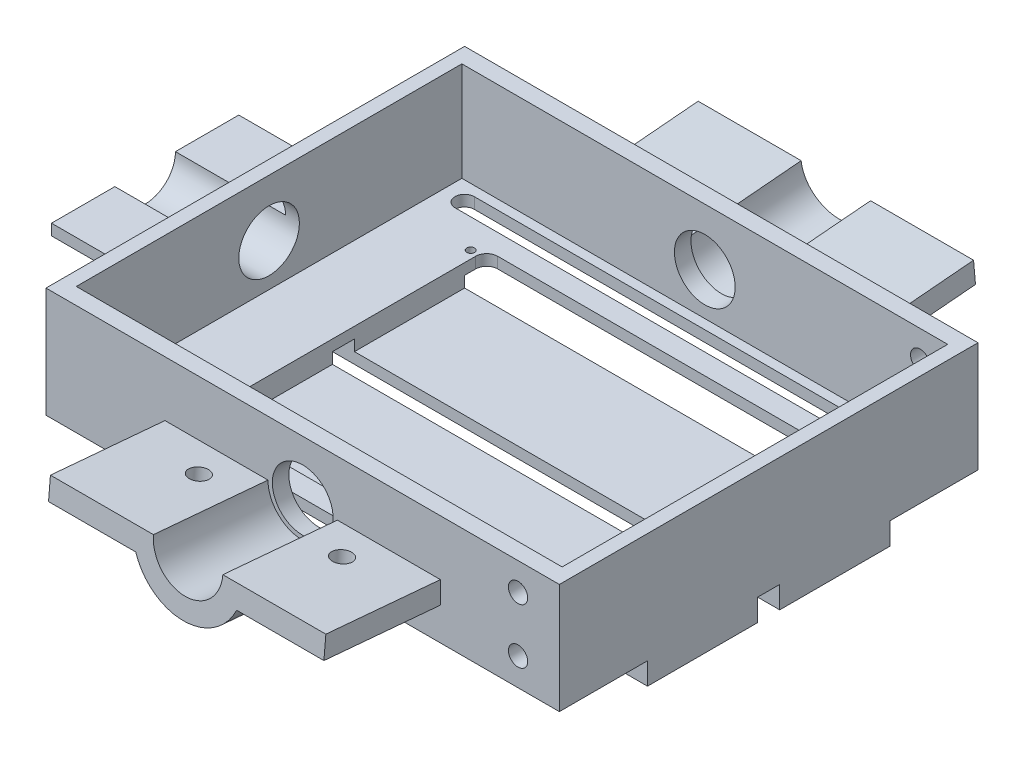
from build123d import *

# Parameters (mm, degrees)
SKETCH1_W            = 7.62
SKETCH1_H            = 88.9
SKETCH1_R            = 0.9
SKETCH1_W_2          = 9.525
BOSS_EXTRUDE1_DEPTH  = 2.54
BOSS_EXTRUDE2_DEPTH  = 25.4
BOSS_EXTRUDE6_DEPTH  = 25.4
BOSS_EXTRUDE7_REACH  = 142.673
SKETCH9_R            = 2.2225
CUT_EXTRUDE2_DEPTH   = 5.08
CUT_EXTRUDE5_REACH   = 142.673
SKETCH15_R           = 7
BOSS_EXTRUDE8_REACH  = 142.673
CUT_EXTRUDE8_REACH   = 142.199
SKETCH19_R           = 6.985
BOSS_EXTRUDE9_DEPTH  = 25.4
CUT_EXTRUDE9_REACH   = 116.313
SKETCH22_R           = 2.2225
SKETCH27_W           = 20.32
SKETCH27_H           = 25.4
BOSS_EXTRUDE12_DEPTH = 5.08
BOSS_EXTRUDE13_REACH = 128.491
SKETCH28_W           = 25.4
SKETCH28_H           = 2.54
SKETCH30_W           = 77.724
SKETCH30_H           = 8.89
BOSS_EXTRUDE14_DEPTH = 2.54
CUT_EXTRUDE10_REACH  = 117.84
SKETCH29_R           = 2.2225
SKETCH32_R           = 2.2225
CUT_EXTRUDE11_DEPTH  = 153.264497495
SKETCH33_W           = 77.724
SKETCH33_H           = 2.54
BOSS_EXTRUDE17_DEPTH = 2.54
FILLET2_R            = 2.54


with BuildPart() as part:
    # Sketch1 → Boss-Extrude1 (new body)
    # profile 1 of 4: a face of its own
    with BuildSketch(Plane(origin=(0, 0, 0), x_dir=(1, 0, 0), z_dir=(0, 1, 0))):
        with Locations((-42.672, 0)):
            Rectangle(SKETCH1_W, SKETCH1_H)
        with Locations(Location((-40.64, -31.115, 0), (0, 0, 270))):
            Circle(SKETCH1_R, mode=Mode.SUBTRACT)
        with Locations(Location((-40.64, 31.115, 0), (0, 0, 270))):
            Circle(SKETCH1_R, mode=Mode.SUBTRACT)
    # profile 2 of 4: a face of its own
    with BuildSketch(Plane(origin=(0, 0, 0), x_dir=(1, 0, 0), z_dir=(0, 1, 0))):
        with Locations((42.672, 0)):
            Rectangle(SKETCH1_W, SKETCH1_H)
        with Locations(Location((40.64, -31.115, 0), (0, 0, 270))):
            Circle(SKETCH1_R, mode=Mode.SUBTRACT)
        with Locations(Location((40.64, 31.115, 0), (0, 0, 270))):
            Circle(SKETCH1_R, mode=Mode.SUBTRACT)
    # profile 3 of 4: a face of its own
    with BuildSketch(Plane(origin=(0, 0, 0), x_dir=(1, 0, 0), z_dir=(0, 1, 0))):
        with Locations((-51.2445, 0)):
            Rectangle(SKETCH1_W_2, SKETCH1_H)
    # profile 4 of 4: a face of its own
    with BuildSketch(Plane(origin=(0, 0, 0), x_dir=(1, 0, 0), z_dir=(0, 1, 0))):
        with Locations((51.2445, 0)):
            Rectangle(SKETCH1_W_2, SKETCH1_H)
    extrude(amount=BOSS_EXTRUDE1_DEPTH)

    # Sketch1<3> → Boss-Extrude2 (add)
    with BuildSketch(Plane(origin=(0, 0, 0), x_dir=(1, 0, 0), z_dir=(0, 1, 0))):
        Polygon((-56.007, -48.26), (-56.007, -44.45), (-56.007, 44.45), (-56.007, 48.26), (-59.182, 48.26), (-59.182, -48.26), align=None)
        Polygon((56.007, -44.45), (56.007, -48.26), (59.182, -48.26), (59.182, 48.26), (56.007, 48.26), (56.007, 44.45), align=None)
        Polygon((-38.862, -44.45), (-46.482, -44.45), (-56.007, -44.45), (-56.007, -48.26), (56.007, -48.26), (56.007, -44.45), (46.482, -44.45), (38.862, -44.45), align=None)
        Polygon((-56.007, 44.45), (-46.482, 44.45), (-38.862, 44.45), (38.862, 44.45), (46.482, 44.45), (56.007, 44.45), (56.007, 48.26), (-56.007, 48.26), align=None)
    extrude(amount=BOSS_EXTRUDE2_DEPTH)



with BuildPart() as body_2:
    # Sketch8 → Boss-Extrude6 (new body)
    with BuildSketch(Plane(origin=(0, 4.383072064, 50.098742937), x_dir=(-1, 0, 0), z_dir=(0, 0.08715574274765835, 0.9961946980917455))):
        with BuildLine():
            ThreePointArc((-11.639742265, -3.317209187), (-12.432110174, -5.802476712), (-12.7, -8.397209187))
            Line((-12.7, -8.397209187), (-8, -8.397209187))
            ThreePointArc((-8, -8.397209187), (0, -0.397209187), (8, -8.397209187))
            Line((8, -8.397209187), (12.7, -8.397209187))
            ThreePointArc((12.7, -8.397209187), (12.432110174, -5.802476712), (11.639742265, -3.317209187))
            ThreePointArc((11.639742265, -3.317209187), (0, 4.302790813), (-11.639742265, -3.317209187))
        make_face()
        with BuildLine():
            Line((-31.75, -8.397209187), (-12.7, -8.397209187))
            ThreePointArc((-12.7, -8.397209187), (-12.432110174, -5.802476712), (-11.639742265, -3.317209187))
            Line((-11.639742265, -3.317209187), (-31.75, -3.317209187))
            Line((-31.75, -3.317209187), (-31.75, -8.397209187))
        make_face()
        with BuildLine():
            ThreePointArc((11.639742265, -3.317209187), (12.432110174, -5.802476712), (12.7, -8.397209187))
            Line((12.7, -8.397209187), (31.75, -8.397209187))
            Line((31.75, -8.397209187), (31.75, -3.317209187))
            Line((31.75, -3.317209187), (11.639742265, -3.317209187))
        make_face()
    extrude(amount=BOSS_EXTRUDE6_DEPTH)


with BuildPart() as body_3:
    # Mirror3: mirrored copy
    add(body_2.part.mirror(Plane.XY))


with BuildPart() as part_1:
    add(part.part)

    add(body_2.part)  # Boss-Extrude7 merges body 2
    # Boss-Extrude7: up to this plane
    boss_extrude7_end = Plane(origin=(0, 25.4, 48.26), z_dir=(0, 0, 1))
    # Sketch10 → Boss-Extrude7 (add, up to the surface)
    with BuildSketch(Plane(origin=(0, 4.383072064, 50.098742937), x_dir=(-1, 0, 0), z_dir=(0, -0.08715574274765835, -0.9961946980917457)), mode=Mode.PRIVATE) as boss_extrude7_sk1:
        with BuildLine():
            Line((11.639742265, 3.317209187), (31.75, 3.317209187))
            Line((31.75, 3.317209187), (31.75, 8.397209187))
            Line((31.75, 8.397209187), (8, 8.397209187))
            ThreePointArc((8, 8.397209187), (0, 0.397209187), (-8, 8.397209187))
            Line((-8, 8.397209187), (-31.75, 8.397209187))
            Line((-31.75, 8.397209187), (-31.75, 3.317209187))
            Line((-31.75, 3.317209187), (-11.639742265, 3.317209187))
            ThreePointArc((-11.639742265, 3.317209187), (0, -4.302790813), (11.639742265, 3.317209187))
        make_face()
    boss_extrude7_tool1 = split(extrude(boss_extrude7_sk1.sketch, amount=BOSS_EXTRUDE7_REACH, mode=Mode.PRIVATE), bisect_by=boss_extrude7_end, keep=Keep.BOTH, mode=Mode.PRIVATE)
    add(boss_extrude7_tool1.solids().sort_by_distance((0, 4.133658, 50.120564))[0])

    # Sketch9 → Cut-Extrude2 (cut)
    with BuildSketch(Plane(origin=(0, 8.36525527, -0.731865004), x_dir=(1, 0, 0), z_dir=(0, 0.9961946980917457, -0.08715574274765837))):
        with Locations(Location((16.51, -56.640111996, 0), (0, 0, 270))):
            Circle(SKETCH9_R)
        with Locations(Location((-16.51, -56.640111996, 0), (0, 0, 270))):
            Circle(SKETCH9_R)
    cut_extrude2 = extrude(amount=-CUT_EXTRUDE2_DEPTH, mode=Mode.SUBTRACT)

    # Cut-Extrude5: up to this plane
    cut_extrude5_end = Plane(origin=(0, 25.4, 44.45), z_dir=(0, 0, -1))
    # Sketch15 → Cut-Extrude5 (cut, up to the surface)
    with BuildSketch(Plane(origin=(0, 4.383072064, 50.098742937), x_dir=(-1, 0, 0), z_dir=(0, 0.08715574274765835, 0.9961946980917455)), mode=Mode.PRIVATE) as cut_extrude5_sk1:
        with Locations(Location((0, -8.397209187, 0), (0, 0, 270))):
            Circle(SKETCH15_R)
    cut_extrude5_tool1 = split(extrude(cut_extrude5_sk1.sketch, amount=-CUT_EXTRUDE5_REACH, mode=Mode.PRIVATE), bisect_by=cut_extrude5_end, keep=Keep.BOTH, mode=Mode.PRIVATE)
    cut_extrude5 = cut_extrude5_tool1.solids().sort_by_distance((0, 12.748327, 49.366878))[0]
    add(cut_extrude5, mode=Mode.SUBTRACT)


    add(body_3.part)  # Boss-Extrude8 merges body 3
    # Boss-Extrude8: up to this plane
    boss_extrude8_end = Plane(origin=(0, 25.4, -48.26), z_dir=(0, 0, 1))
    # Sketch16 → Boss-Extrude8 (add, up to the surface)
    with BuildSketch(Plane(origin=(0, 4.383072064, -50.098742937), x_dir=(1, 0, 0), z_dir=(0, -0.08715574274765835, 0.9961946980917457)), mode=Mode.PRIVATE) as boss_extrude8_sk1:
        with BuildLine():
            Line((11.639742265, 3.317209187), (31.75, 3.317209187))
            Line((31.75, 3.317209187), (31.75, 8.397209187))
            Line((31.75, 8.397209187), (8, 8.397209187))
            ThreePointArc((8, 8.397209187), (0, 0.397209187), (-8, 8.397209187))
            Line((-8, 8.397209187), (-31.75, 8.397209187))
            Line((-31.75, 8.397209187), (-31.75, 3.317209187))
            Line((-31.75, 3.317209187), (-11.639742265, 3.317209187))
            ThreePointArc((-11.639742265, 3.317209187), (0, -4.302790813), (11.639742265, 3.317209187))
        make_face()
    boss_extrude8_tool1 = split(extrude(boss_extrude8_sk1.sketch, amount=BOSS_EXTRUDE8_REACH, mode=Mode.PRIVATE), bisect_by=boss_extrude8_end, keep=Keep.BOTH, mode=Mode.PRIVATE)
    add(boss_extrude8_tool1.solids().sort_by_distance((0, 4.133658, -50.120564))[0])

    # Mirror6: Cut-Extrude2, Cut-Extrude5 across plane
    add(cut_extrude2.mirror(Plane.XY), mode=Mode.SUBTRACT)
    add(cut_extrude5.mirror(Plane.XY), mode=Mode.SUBTRACT)

    # Sketch19 → Cut-Extrude8 (cut, up to next)
    with BuildSketch(Plane(origin=(-56.007, 0, 0), x_dir=(0, 0, -1), z_dir=(1, 0, 0)), mode=Mode.PRIVATE) as cut_extrude8_sk1:
        with Locations((0, 12.318156255)):
            Circle(SKETCH19_R)
    cut_extrude8_tool1 = extrude(cut_extrude8_sk1.sketch, amount=-CUT_EXTRUDE8_REACH, mode=Mode.PRIVATE) & part_1.part
    add(cut_extrude8_tool1.solids().sort_by_distance((-56.007, 12.318156, 0))[0], mode=Mode.SUBTRACT)

    # Sketch20 → Boss-Extrude9 (add)
    with BuildSketch(Plane.ZY.offset(59.182)):
        with BuildLine():
            ThreePointArc((8.519418994, 9.778156255), (8.79686691, 11.03471067), (8.89, 12.318156255))
            Line((8.89, 12.318156255), (6.985, 12.318156255))
            ThreePointArc((6.985, 12.318156255), (4.939140867, 7.379015389), (0, 5.333156255))
            Line((0, 5.333156255), (0, 3.428156255))
            ThreePointArc((0, 3.428156255), (5.312791168, 5.190298933), (8.519418994, 9.778156255))
        make_face()
        with BuildLine():
            Line((-6.985, 12.318156255), (-8.89, 12.318156255))
            ThreePointArc((-8.89, 12.318156255), (-8.79686691, 11.03471067), (-8.519418994, 9.778156255))
            ThreePointArc((-8.519418994, 9.778156255), (-5.312791168, 5.190298933), (0, 3.428156255))
            Line((0, 3.428156255), (0, 5.333156255))
            ThreePointArc((0, 5.333156255), (-4.939140867, 7.379015389), (-6.985, 12.318156255))
        make_face()
        with BuildLine():
            ThreePointArc((-8.519418994, 9.778156255), (-8.79686691, 11.03471067), (-8.89, 12.318156255))
            Line((-8.89, 12.318156255), (-21.59, 12.318156255))
            Line((-21.59, 12.318156255), (-21.59, 9.778156255))
            Line((-21.59, 9.778156255), (-8.519418994, 9.778156255))
        make_face()
        with BuildLine():
            Line((21.59, 12.318156255), (8.89, 12.318156255))
            ThreePointArc((8.89, 12.318156255), (8.79686691, 11.03471067), (8.519418994, 9.778156255))
            Line((8.519418994, 9.778156255), (21.59, 9.778156255))
            Line((21.59, 9.778156255), (21.59, 12.318156255))
        make_face()
    extrude(amount=BOSS_EXTRUDE9_DEPTH)

    # Sketch22 → Cut-Extrude9 (cut, up to next)
    with BuildSketch(Plane(origin=(0, 12.318156255, 0), x_dir=(1, 0, 0), z_dir=(0, 1, 0)), mode=Mode.PRIVATE) as cut_extrude9_sk1:
        with Locations(Location((-65.532, 14.2875, 0), (0, 0, 270))):
            Circle(SKETCH22_R)
    cut_extrude9_tool1 = extrude(cut_extrude9_sk1.sketch, amount=-CUT_EXTRUDE9_REACH, mode=Mode.PRIVATE) & part_1.part
    # Sketch22 → Cut-Extrude9 (cut, up to next)
    with BuildSketch(Plane(origin=(0, 12.318156255, 0), x_dir=(1, 0, 0), z_dir=(0, 1, 0)), mode=Mode.PRIVATE) as cut_extrude9_sk2:
        with Locations(Location((-65.532, -14.2875, 0), (0, 0, 90))):
            Circle(SKETCH22_R)
    cut_extrude9_tool2 = extrude(cut_extrude9_sk2.sketch, amount=-CUT_EXTRUDE9_REACH, mode=Mode.PRIVATE) & part_1.part
    add(cut_extrude9_tool1.solids().sort_by_distance((-65.532, 12.318156, -14.2875))[0], mode=Mode.SUBTRACT)
    add(cut_extrude9_tool2.solids().sort_by_distance((-65.532, 12.318156, 14.2875))[0], mode=Mode.SUBTRACT)

    # Sketch27 → Boss-Extrude12 (add)
    with BuildSketch(Plane.XZ):
        with Locations((-49.022, 15.24)):
            Rectangle(SKETCH27_W, SKETCH27_H)
        with Locations((-49.022, -15.24)):
            Rectangle(SKETCH27_W, SKETCH27_H)
        with Locations((49.022, -15.24)):
            Rectangle(SKETCH27_W, SKETCH27_H)
        with Locations((49.022, 15.24)):
            Rectangle(SKETCH27_W, SKETCH27_H)
    extrude(amount=BOSS_EXTRUDE12_DEPTH)

    # Sketch28 → Boss-Extrude13 (add, up to next)
    with BuildSketch(Plane(origin=(-38.862, 0, 0), x_dir=(0, 0, -1), z_dir=(1, 0, 0)), mode=Mode.PRIVATE) as boss_extrude13_sk1:
        with Locations((15.24, -3.81)):
            Rectangle(SKETCH28_W, SKETCH28_H)
    boss_extrude13_tool1 = extrude(boss_extrude13_sk1.sketch, amount=BOSS_EXTRUDE13_REACH, mode=Mode.PRIVATE) - part_1.part
    # Sketch28 → Boss-Extrude13 (add, up to next)
    with BuildSketch(Plane(origin=(-38.862, 0, 0), x_dir=(0, 0, -1), z_dir=(1, 0, 0)), mode=Mode.PRIVATE) as boss_extrude13_sk2:
        with Locations((-15.24, -3.81)):
            Rectangle(SKETCH28_W, SKETCH28_H)
    boss_extrude13_tool2 = extrude(boss_extrude13_sk2.sketch, amount=BOSS_EXTRUDE13_REACH, mode=Mode.PRIVATE) - part_1.part
    add(boss_extrude13_tool1.solids().sort_by_distance((-38.862, -3.81, -15.24))[0])
    add(boss_extrude13_tool2.solids().sort_by_distance((-38.862, -3.81, 15.24))[0])

    # Sketch30 → Boss-Extrude14 (add)
    with BuildSketch(Plane(origin=(0, 2.54, 0), x_dir=(1, 0, 0), z_dir=(0, 1, 0))):
        with Locations((0, 40.005)):
            Rectangle(SKETCH30_W, SKETCH30_H)
        with Locations((0, -40.005)):
            Rectangle(SKETCH30_W, SKETCH30_H)
    extrude(amount=-BOSS_EXTRUDE14_DEPTH)

    # Sketch29 → Cut-Extrude10 (cut, up to next)
    with BuildSketch(Plane(origin=(0, 2.54, 0), x_dir=(1, 0, 0), z_dir=(0, 1, 0)), mode=Mode.PRIVATE) as cut_extrude10_sk1:
        with BuildLine():
            Line((38.862, 42.2275), (-50.927, 42.2275))
            ThreePointArc((-50.927, 42.2275), (-49.355455179, 41.576544821), (-48.7045, 40.005))
            ThreePointArc((-48.7045, 40.005), (-49.355455179, 38.433455179), (-50.927, 37.7825))
            Line((-50.927, 37.7825), (38.862, 37.7825))
            Line((38.862, 37.7825), (38.862, 42.2275))
        make_face()
    cut_extrude10_tool1 = extrude(cut_extrude10_sk1.sketch, amount=-CUT_EXTRUDE10_REACH, mode=Mode.PRIVATE) & part_1.part
    # Sketch29 → Cut-Extrude10 (cut, up to next)
    with BuildSketch(Plane(origin=(0, 2.54, 0), x_dir=(1, 0, 0), z_dir=(0, 1, 0)), mode=Mode.PRIVATE) as cut_extrude10_sk2:
        with Locations((-50.927, 40.005)):
            Circle(SKETCH29_R)
    cut_extrude10_tool2 = extrude(cut_extrude10_sk2.sketch, amount=-CUT_EXTRUDE10_REACH, mode=Mode.PRIVATE) & part_1.part
    # Sketch29 → Cut-Extrude10 (cut, up to next)
    with BuildSketch(Plane(origin=(0, 2.54, 0), x_dir=(1, 0, 0), z_dir=(0, 1, 0)), mode=Mode.PRIVATE) as cut_extrude10_sk3:
        with BuildLine():
            Line((50.927, 42.2275), (38.862, 42.2275))
            Line((38.862, 42.2275), (38.862, 37.7825))
            Line((38.862, 37.7825), (50.927, 37.7825))
            ThreePointArc((50.927, 37.7825), (48.7045, 40.005), (50.927, 42.2275))
        make_face()
    cut_extrude10_tool3 = extrude(cut_extrude10_sk3.sketch, amount=-CUT_EXTRUDE10_REACH, mode=Mode.PRIVATE) & part_1.part
    # Sketch29 → Cut-Extrude10 (cut, up to next)
    with BuildSketch(Plane(origin=(0, 2.54, 0), x_dir=(1, 0, 0), z_dir=(0, 1, 0)), mode=Mode.PRIVATE) as cut_extrude10_sk4:
        with Locations((50.927, 40.005)):
            Circle(SKETCH29_R)
    cut_extrude10_tool4 = extrude(cut_extrude10_sk4.sketch, amount=-CUT_EXTRUDE10_REACH, mode=Mode.PRIVATE) & part_1.part
    # Sketch29 → Cut-Extrude10 (cut, up to next)
    with BuildSketch(Plane(origin=(0, 2.54, 0), x_dir=(1, 0, 0), z_dir=(0, 1, 0)), mode=Mode.PRIVATE) as cut_extrude10_sk5:
        with BuildLine():
            Line((38.862, -42.2275), (38.862, -37.7825))
            Line((38.862, -37.7825), (-50.927, -37.7825))
            ThreePointArc((-50.927, -37.7825), (-49.355455179, -38.433455179), (-48.7045, -40.005))
            ThreePointArc((-48.7045, -40.005), (-49.355455179, -41.576544821), (-50.927, -42.2275))
            Line((-50.927, -42.2275), (38.862, -42.2275))
        make_face()
    cut_extrude10_tool5 = extrude(cut_extrude10_sk5.sketch, amount=-CUT_EXTRUDE10_REACH, mode=Mode.PRIVATE) & part_1.part
    # Sketch29 → Cut-Extrude10 (cut, up to next)
    with BuildSketch(Plane(origin=(0, 2.54, 0), x_dir=(1, 0, 0), z_dir=(0, 1, 0)), mode=Mode.PRIVATE) as cut_extrude10_sk6:
        with BuildLine():
            Line((50.927, -37.7825), (38.862, -37.7825))
            Line((38.862, -37.7825), (38.862, -42.2275))
            Line((38.862, -42.2275), (50.927, -42.2275))
            ThreePointArc((50.927, -42.2275), (48.7045, -40.005), (50.927, -37.7825))
        make_face()
    cut_extrude10_tool6 = extrude(cut_extrude10_sk6.sketch, amount=-CUT_EXTRUDE10_REACH, mode=Mode.PRIVATE) & part_1.part
    # Sketch29 → Cut-Extrude10 (cut, up to next)
    with BuildSketch(Plane(origin=(0, 2.54, 0), x_dir=(1, 0, 0), z_dir=(0, 1, 0)), mode=Mode.PRIVATE) as cut_extrude10_sk7:
        with Locations((50.927, -40.005)):
            Circle(SKETCH29_R)
    cut_extrude10_tool7 = extrude(cut_extrude10_sk7.sketch, amount=-CUT_EXTRUDE10_REACH, mode=Mode.PRIVATE) & part_1.part
    # Sketch29 → Cut-Extrude10 (cut, up to next)
    with BuildSketch(Plane(origin=(0, 2.54, 0), x_dir=(1, 0, 0), z_dir=(0, 1, 0)), mode=Mode.PRIVATE) as cut_extrude10_sk8:
        with Locations((-50.927, -40.005)):
            Circle(SKETCH29_R)
    cut_extrude10_tool8 = extrude(cut_extrude10_sk8.sketch, amount=-CUT_EXTRUDE10_REACH, mode=Mode.PRIVATE) & part_1.part
    add(cut_extrude10_tool1.solids().sort_by_distance((-5.161124, 2.54, -40.005))[0], mode=Mode.SUBTRACT)
    add(cut_extrude10_tool2.solids().sort_by_distance((-50.927, 2.54, -40.005))[0], mode=Mode.SUBTRACT)
    add(cut_extrude10_tool3.solids().sort_by_distance((44.033649, 2.54, -40.005))[0], mode=Mode.SUBTRACT)
    add(cut_extrude10_tool4.solids().sort_by_distance((50.927, 2.54, -40.005))[0], mode=Mode.SUBTRACT)
    add(cut_extrude10_tool5.solids().sort_by_distance((-5.161124, 2.54, 40.005))[0], mode=Mode.SUBTRACT)
    add(cut_extrude10_tool6.solids().sort_by_distance((44.033649, 2.54, 40.005))[0], mode=Mode.SUBTRACT)
    add(cut_extrude10_tool7.solids().sort_by_distance((50.927, 2.54, 40.005))[0], mode=Mode.SUBTRACT)
    add(cut_extrude10_tool8.solids().sort_by_distance((-50.927, 2.54, 40.005))[0], mode=Mode.SUBTRACT)

    # Sketch32 → Cut-Extrude11 (cut, through all)
    with BuildSketch(Plane.XY.offset(48.26)):
        with Locations((49.657, 19.05)):
            Circle(SKETCH32_R)
        with Locations((49.657, 6.35)):
            Circle(SKETCH32_R)
    extrude(amount=-CUT_EXTRUDE11_DEPTH, mode=Mode.SUBTRACT)

    # Sketch33 → Boss-Extrude17 (add)
    with BuildSketch(Plane.XY.offset(-35.56)):
        with Locations((0, 1.27)):
            Rectangle(SKETCH33_W, SKETCH33_H)
    boss_extrude17 = extrude(amount=BOSS_EXTRUDE17_DEPTH)

    # Mirror8: Boss-Extrude17 across plane
    add(boss_extrude17.mirror(Plane.XY))

    # Fillet2
    fillet2_edges = [part_1.edges().sort_by_distance(p)[0] for p in [
        (-38.862, 1.27, -33.02),
        (38.862, 1.27, -33.02),
        (-38.862, 1.27, 33.02),
        (38.862, 1.27, 33.02),
    ]]
    fillet(fillet2_edges, radius=FILLET2_R)


solid = part_1.part
